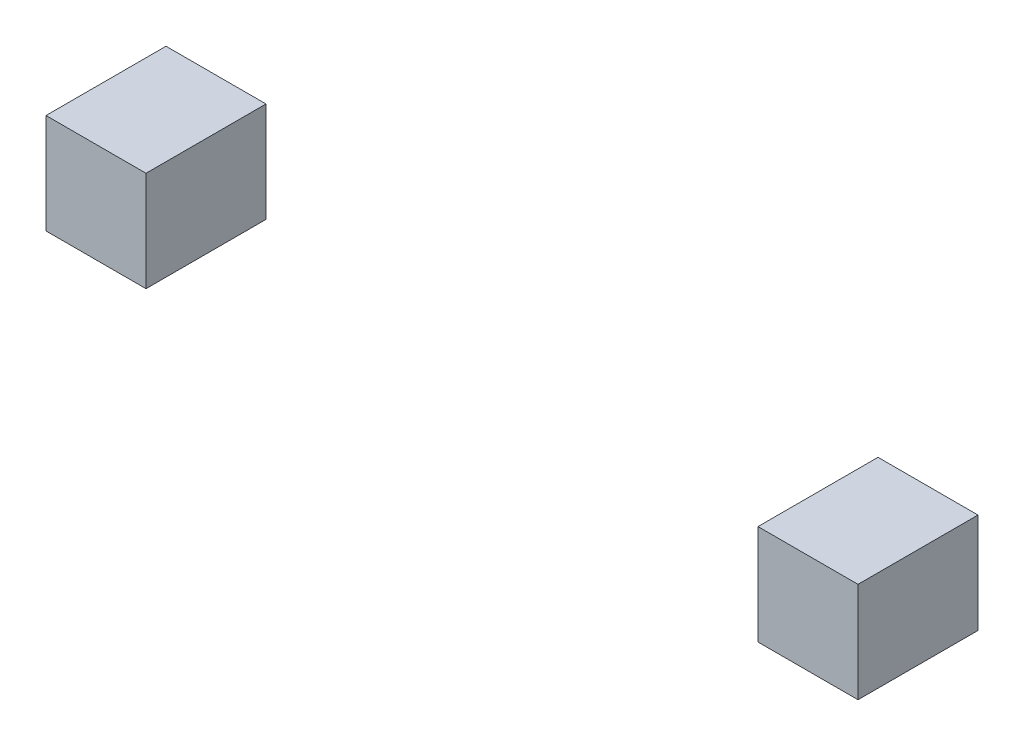
from build123d import *

# Parameters (mm, degrees)
SKETCH1_W             = 75
SKETCH1_H             = 75
BOSS_EXTRUDE1_DEPTH   = 90
BOSS_EXTRUDE1_2_DEPTH = 90


with BuildPart() as part:
    # Sketch1 → Boss-Extrude1 (new body)
    with BuildSketch(Plane.XY):
        with Locations((267.5, 676.29)):
            Rectangle(SKETCH1_W, SKETCH1_H)
    extrude(amount=BOSS_EXTRUDE1_DEPTH)


with BuildPart() as body_2:
    # Sketch1 → Boss-Extrude1 2 (new body)
    with BuildSketch(Plane.XY):
        with Locations((-266.5, 676.29)):
            Rectangle(SKETCH1_W, SKETCH1_H)
    extrude(amount=BOSS_EXTRUDE1_2_DEPTH)


solid = Compound([part.part, body_2.part])
